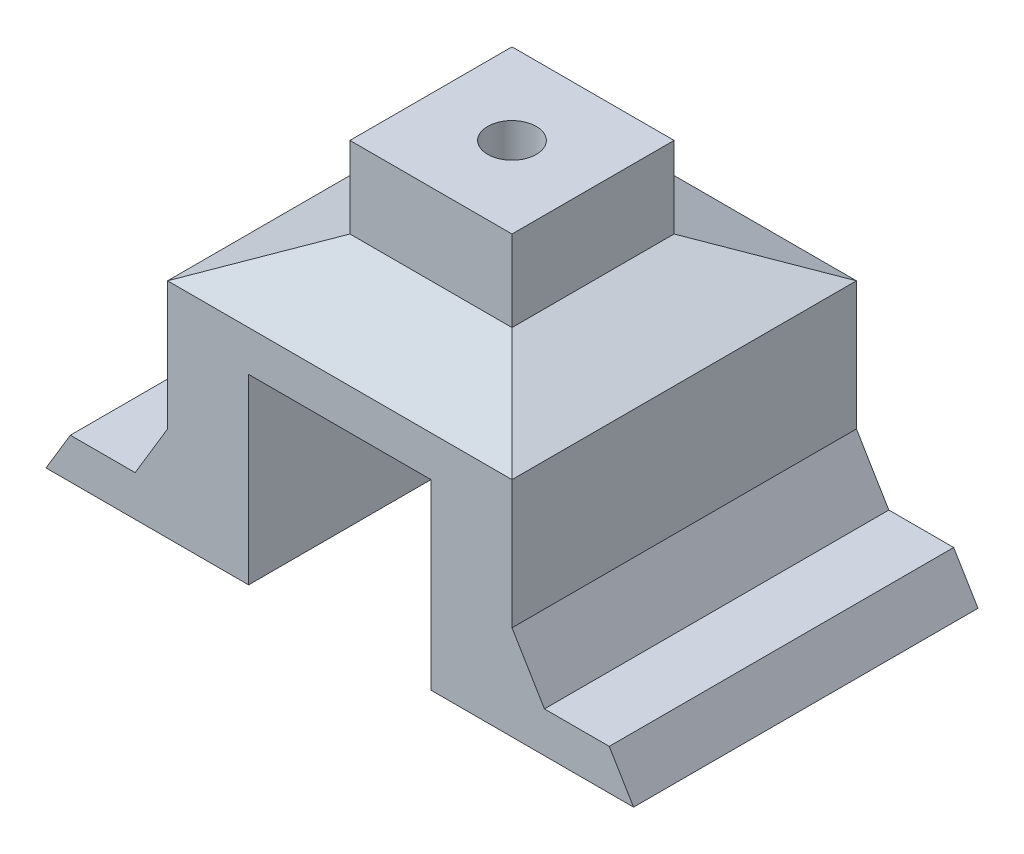
from build123d import *

# Parameters (mm, degrees)
BOSS_EXTRUDE1_DEPTH     = 21.25
CUT_EXTRUDE1_DEPTH      = 60.765165439
CUT_EXTRUDE1_DEPTH_BACK = 60.765165439
SKETCH3_R               = 3
CUT_EXTRUDE2_DEPTH      = 60.765165439


with BuildPart() as part:
    # Sketch1 → Boss-Extrude1 (new, symmetric)
    with BuildSketch(Plane.XY):
        Polygon((-11.25, 0), (-11.25, 22.5), (11.25, 22.5), (11.25, 0), (36.25, 0), (33.25, 5), (25.25, 5), (21.25, 11.666666667), (21.25, 27.5), (10, 32.5), (10, 42.5), (-10, 42.5), (-10, 32.5), (-21.25, 27.5), (-21.25, 11.666666667), (-25.25, 5), (-33.25, 5), (-36.25, 0), align=None)
    extrude(amount=BOSS_EXTRUDE1_DEPTH, both=True)

    # Sketch2 → Cut-Extrude1 (cut, two sides: drawn at the far end of the back side and taken through both)
    with BuildSketch(Plane(origin=(0, 0, 0), x_dir=(0, 0, -1), z_dir=(1, 0, 0)).offset(-CUT_EXTRUDE1_DEPTH_BACK)):
        Polygon((21.25, 27.5), (10, 32.5), (10, 42.5), (21.25, 42.5), align=None)
        Polygon((-10, 42.5), (-10, 32.5), (-21.25, 27.5), (-21.25, 42.5), align=None)
    extrude(amount=CUT_EXTRUDE1_DEPTH + CUT_EXTRUDE1_DEPTH_BACK, mode=Mode.SUBTRACT)

    # Sketch3 → Cut-Extrude2 (cut, through all)
    with BuildSketch(Plane(origin=(0, 42.5, 0), x_dir=(1, 0, 0), z_dir=(0, 1, 0))):
        with Locations(Location((0, 0, 0), (0, 0, 270))):
            Circle(SKETCH3_R)
    extrude(amount=-CUT_EXTRUDE2_DEPTH, mode=Mode.SUBTRACT)


solid = part.part
